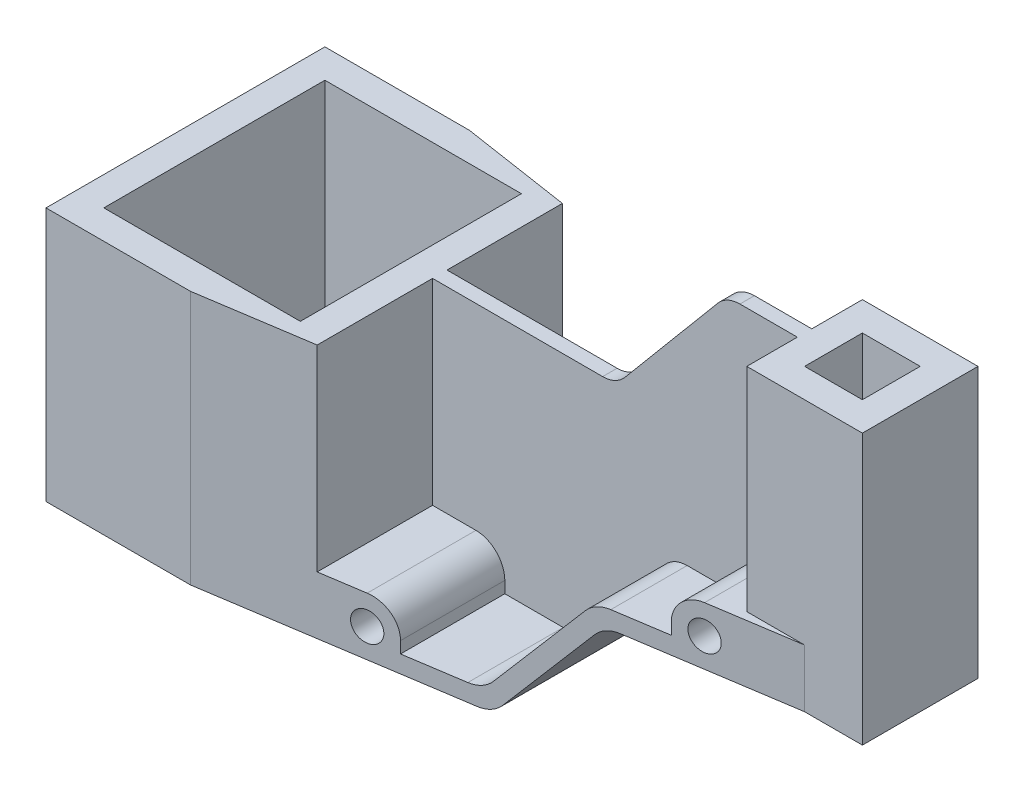
from build123d import *

# Parameters (mm, degrees)
ESQUISSE1_W                   = 88
ESQUISSE1_H                   = 96.5
ESQUISSE1_W_2                 = 68
ESQUISSE1_H_2                 = 76.5
BOSS_EXTRU_3_DEPTH            = 88
BOSS_EXTRU_4_DEPTH            = 96.5
ESQUISSE7_W                   = 40
ESQUISSE7_H                   = 40
ESQUISSE7_W_2                 = 20
ESQUISSE7_H_2                 = 20
BOSS_EXTRU_11_DEPTH           = 93.5
ENL_V_MAT_EXTRU_9_REACH       = 234.761
ESQUISSE13_W                  = 10
ESQUISSE13_H                  = 20
BOSS_EXTRU_12_DEPTH           = 2.5
ESQUISSE17_R                  = 5
ESQUISSE17_W                  = 40
ESQUISSE17_H                  = 20
BOSS_EXTRU_13_DEPTH           = 48.25
ENL_V_MAT_EXTRU_12_DEPTH      = 255.148142389
ENL_V_MAT_EXTRU_12_DEPTH_BACK = 255.148142389
ESQUISSE18_R                  = 5
ENL_V_MAT_EXTRU_13_REACH      = 229.868
ESQUISSE19_W                  = 10
ESQUISSE19_H                  = 20
CONG_1_R                      = 10
ENL_V_MAT_EXTRU_15_DEPTH      = 88


with BuildPart() as part:
    # Esquisse1 → Boss.-Extru.3 (new body)
    with BuildSketch(Plane(origin=(0, 0, 0), x_dir=(1, 0, 0), z_dir=(0, 1, 0))):
        Rectangle(ESQUISSE1_W, ESQUISSE1_H)
        Rectangle(ESQUISSE1_W_2, ESQUISSE1_H_2, mode=Mode.SUBTRACT)
    extrude(amount=BOSS_EXTRU_3_DEPTH)

    # Esquisse3 → Boss.-Extru.4 (add)
    with BuildSketch(Plane.XY.offset(48.25)):
        Polygon((44, 6), (44, 0), (96.658434537, 0), (130.222419784, 40), (190.222419784, 40), (190.222419784, 46), (127.424573836, 46), (93.860588588, 6), align=None)
    extrude(amount=-BOSS_EXTRU_4_DEPTH)

    # Esquisse7 → Boss.-Extru.11 (add)
    with BuildSketch(Plane.XZ.offset(-40)):
        with Locations((190.222419784, 0)):
            Rectangle(ESQUISSE7_W, ESQUISSE7_H)
        with Locations((190.222419784, 0)):
            Rectangle(ESQUISSE7_W_2, ESQUISSE7_H_2, mode=Mode.SUBTRACT)
    extrude(amount=-BOSS_EXTRU_11_DEPTH)

    # Esquisse13 → Enlèv. mat.-Extru.9 (cut, up to next)
    with BuildSketch(Plane(origin=(0, 46, 0), x_dir=(1, 0, 0), z_dir=(0, 1, 0)), mode=Mode.PRIVATE) as enl_v_mat_extru_9_sk1:
        with Locations((185.222419784, 0)):
            Rectangle(ESQUISSE13_W, ESQUISSE13_H)
    enl_v_mat_extru_9_tool1 = extrude(enl_v_mat_extru_9_sk1.sketch, amount=-ENL_V_MAT_EXTRU_9_REACH, mode=Mode.PRIVATE) & part.part
    add(enl_v_mat_extru_9_tool1.solids().sort_by_distance((185.22242, 46, 0))[0], mode=Mode.SUBTRACT)

    # Esquisse14 → Boss.-Extru.12 (add, symmetric)
    with BuildSketch(Plane.XY):
        Polygon((44, 88), (107.513300371, 88), (145.692333589, 133.5), (170.222419784, 133.5), (170.222419784, 46), (127.424573836, 46), (93.860588588, 6), (44, 6), align=None)
    extrude(amount=BOSS_EXTRU_12_DEPTH, both=True)

    # Esquisse17 → Boss.-Extru.13 (add, symmetric)
    # profile 1 of 2: a face of its own
    with BuildSketch(Plane.XY):
        Polygon((44, 20), (44, 0), (69, 0), (69, 6), (69, 20), align=None)
        with Locations((59, 10)):
            Circle(ESQUISSE17_R, mode=Mode.SUBTRACT)
    # profile 2 of 2: a face of its own
    with BuildSketch(Plane.XY):
        with Locations((170.222419784, 50)):
            Rectangle(ESQUISSE17_W, ESQUISSE17_H)
        with Locations((160.222419784, 50)):
            Circle(ESQUISSE17_R, mode=Mode.SUBTRACT)
    extrude(amount=BOSS_EXTRU_13_DEPTH, both=True)

    # Esquisse18 → Enlèv. mat.-Extru.12 (cut, two sides: drawn at the far end of the back side and taken through both)
    with BuildSketch(Plane.XY.offset(2.5).offset(-ENL_V_MAT_EXTRU_12_DEPTH_BACK)):
        with Locations((160.222419784, 50)):
            Circle(ESQUISSE18_R)
        with Locations((59, 10)):
            Circle(ESQUISSE18_R)
    extrude(amount=ENL_V_MAT_EXTRU_12_DEPTH + ENL_V_MAT_EXTRU_12_DEPTH_BACK, mode=Mode.SUBTRACT)

    # Esquisse19 → Enlèv. mat.-Extru.13 (cut, up to next)
    with BuildSketch(Plane(origin=(0, 60, 0), x_dir=(1, 0, 0), z_dir=(0, 1, 0)), mode=Mode.PRIVATE) as enl_v_mat_extru_13_sk1:
        with Locations((185.222419784, 0)):
            Rectangle(ESQUISSE19_W, ESQUISSE19_H)
    enl_v_mat_extru_13_tool1 = extrude(enl_v_mat_extru_13_sk1.sketch, amount=-ENL_V_MAT_EXTRU_13_REACH, mode=Mode.PRIVATE) & part.part
    add(enl_v_mat_extru_13_tool1.solids().sort_by_distance((185.22242, 60, 0))[0], mode=Mode.SUBTRACT)

    # Congé1
    cong_1_edges = [part.edges().sort_by_distance(p)[0] for p in [
        (93.860588588, 6, 25.375),
        (127.424573836, 46, 25.375),
        (145.692333589, 133.5, 0),
        (107.513300371, 88, 0),
        (69, 20, -25.375),
        (69, 20, 25.375),
        (150.222419784, 60, 25.375),
        (150.222419784, 60, -25.375),
        (127.424573836, 46, -25.375),
        (93.860588588, 6, -25.375),
        (96.658434537, 0, 0),
        (130.222419784, 40, 0),
    ]]
    fillet(cong_1_edges, radius=CONG_1_R)

    # Esquisse20 → Enlèv. mat.-Extru.15 (cut)
    with BuildSketch(Plane(origin=(0, 0, 0), x_dir=(1, 0, 0), z_dir=(0, 1, 0))):
        Polygon((6, 48.25), (190.222419784, 20), (210.222419784, 20), (210.222419784, 48.25), align=None)
        Polygon((210.222419784, -20), (190.222419784, -20), (6, -48.25), (210.222419784, -48.25), align=None)
    extrude(amount=ENL_V_MAT_EXTRU_15_DEPTH, mode=Mode.SUBTRACT)


solid = part.part
